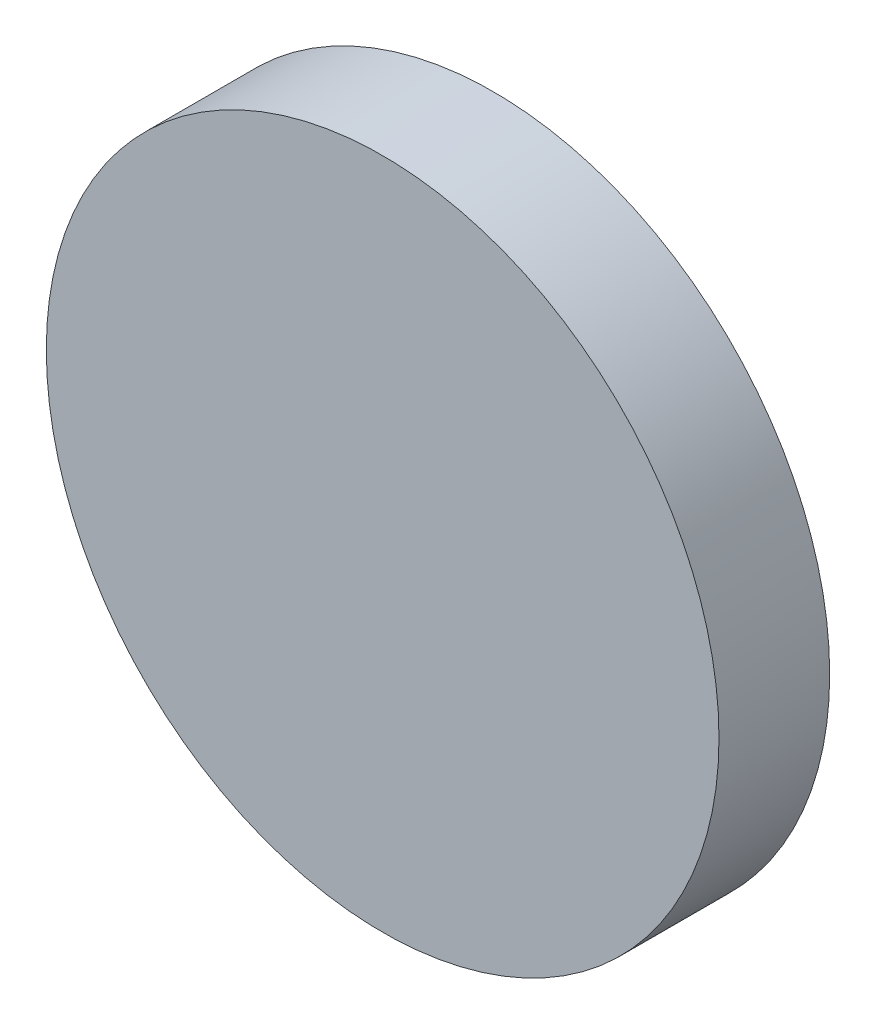
from build123d import *

# Parameters (mm, degrees)
SKETCH1_R           = 39.5
BOSS_EXTRUDE1_DEPTH = 13


with BuildPart() as part:
    # Sketch1 → Boss-Extrude1 (new body)
    with BuildSketch(Plane.XY):
        with Locations(Location((0, 0, 0), (0, 0, 180))):
            Circle(SKETCH1_R)
    extrude(amount=BOSS_EXTRUDE1_DEPTH)


solid = part.part
